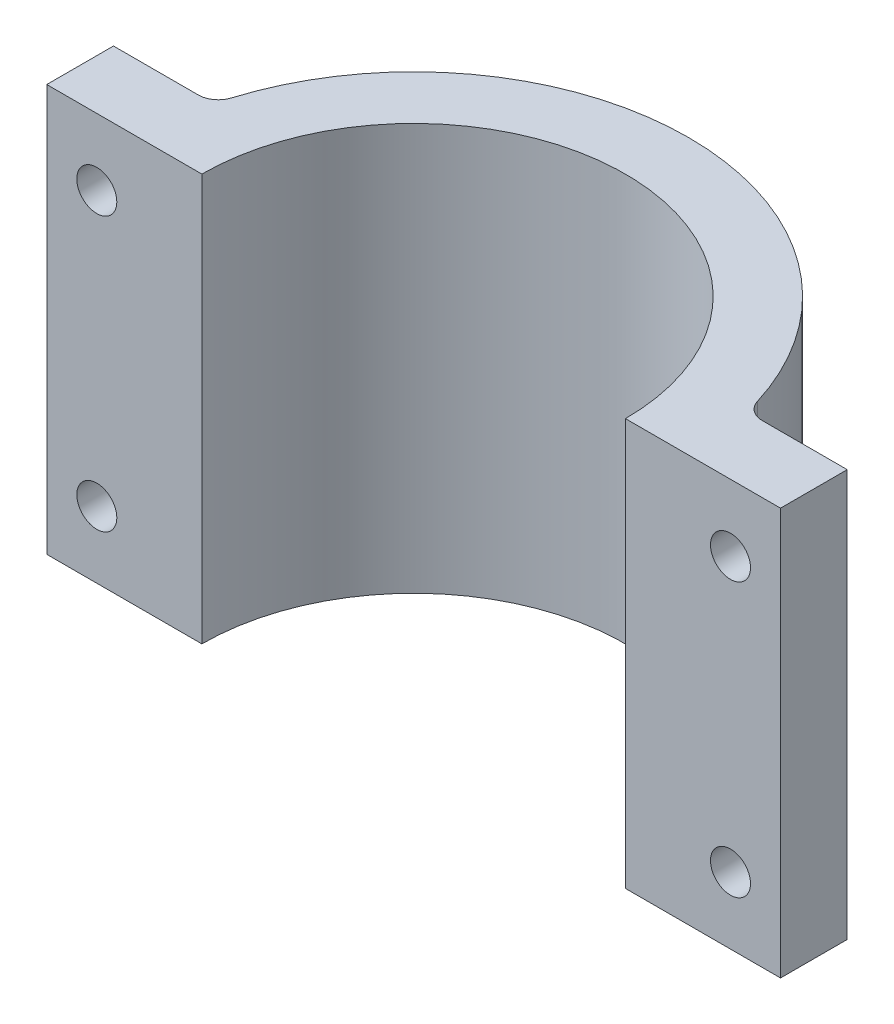
from build123d import *

# Parameters (mm, degrees)
BOSS_EXTRUDE1_DEPTH     = 61
CUT_EXTRUDE1_DEPTH      = 88.871376881
CUT_EXTRUDE1_DEPTH_BACK = 88.871376881
SKETCH2_R               = 3
FILLET1_R               = 3


with BuildPart() as part:
    # Sketch1 → Boss-Extrude1 (new body)
    with BuildSketch(Plane(origin=(0, 0, 0), x_dir=(1, 0, 0), z_dir=(0, 1, 0))):
        with BuildLine():
            Line((40, -51.75), (31.75, -51.75))
            ThreePointArc((31.75, -51.75), (0, -20), (-31.75, -51.75))
            Line((-31.75, -51.75), (-40, -51.75))
            Line((-40, -51.75), (-55, -51.75))
            Line((-55, -51.75), (-55, -41.75))
            Line((-55, -41.75), (-40, -41.75))
            ThreePointArc((-40, -41.75), (0, -10.518943744), (40, -41.75))
            Line((40, -41.75), (55, -41.75))
            Line((55, -41.75), (55, -51.75))
            Line((55, -51.75), (40, -51.75))
        make_face()
    extrude(amount=BOSS_EXTRUDE1_DEPTH)

    # Sketch2 → Cut-Extrude1 (cut, two sides: drawn at the far end of the back side and taken through both)
    with BuildSketch(Plane(origin=(0, 0, 41.75), x_dir=(-1, 0, 0), z_dir=(0, 0, -1)).offset(-CUT_EXTRUDE1_DEPTH_BACK)):
        with Locations((-47.5, 51)):
            Circle(SKETCH2_R)
        with Locations((-47.5, 10)):
            Circle(SKETCH2_R)
        with Locations((47.5, 10)):
            Circle(SKETCH2_R)
        with Locations((47.5, 51)):
            Circle(SKETCH2_R)
    extrude(amount=CUT_EXTRUDE1_DEPTH + CUT_EXTRUDE1_DEPTH_BACK, mode=Mode.SUBTRACT)

    # Fillet1
    fillet1_edges = [part.edges().sort_by_distance(p)[0] for p in [
        (-40, 30.5, 41.75),
        (40, 30.5, 41.75),
    ]]
    fillet(fillet1_edges, radius=FILLET1_R)


solid = part.part
